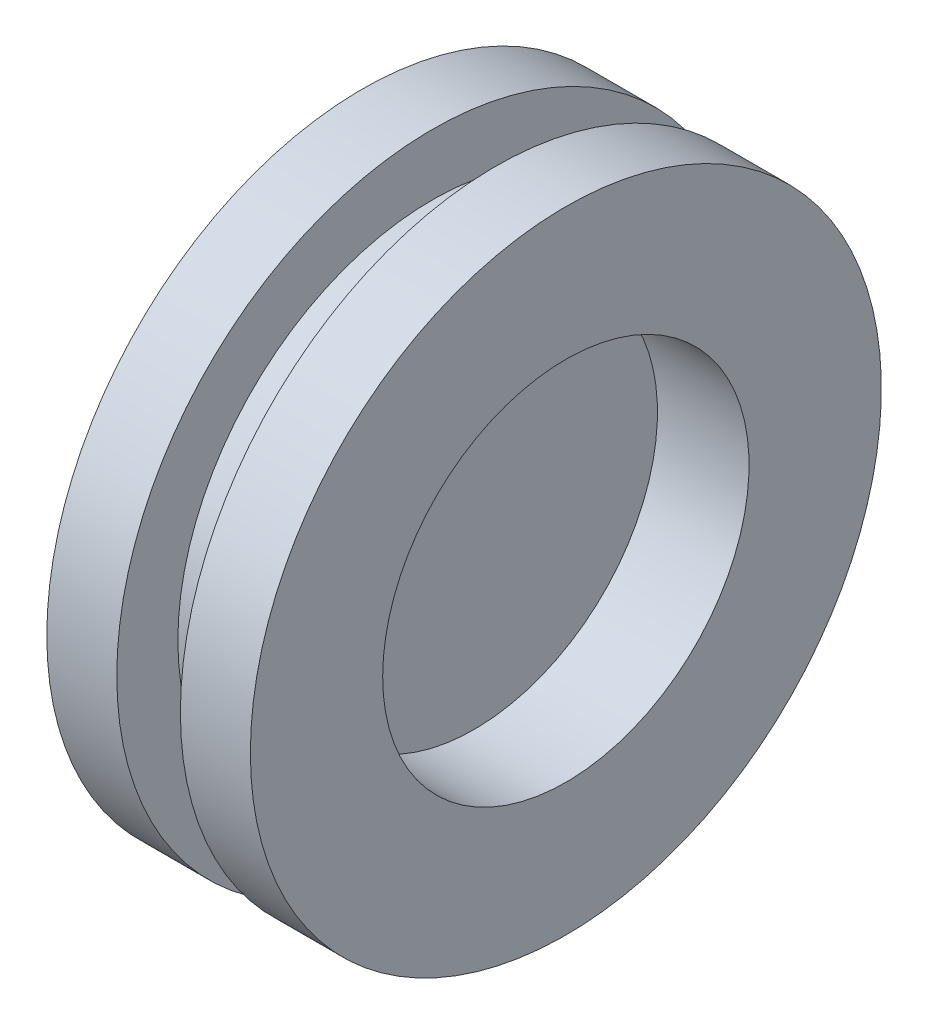
from build123d import *


with BuildPart() as part:
    # Sketch1 → Revolve1 (revolve)
    with BuildSketch(Plane.XY, mode=Mode.PRIVATE) as revolve1_sk:
        Polygon((-0.254, 0), (0.254, 0), (0.254, 4.572), (2.54, 4.572), (2.54, 7.874), (0.79375, 7.874), (0.79375, 6.35), (-0.79375, 6.35), (-0.79375, 7.874), (-2.54, 7.874), (-2.54, 4.572), (-0.254, 4.572), align=None)
    revolve(revolve1_sk.sketch.rotate(Axis((-3.81, 0, 0), (1, 0, 0)), 90), axis=Axis((-3.81, 0, 0), (1, 0, 0)))


solid = part.part
